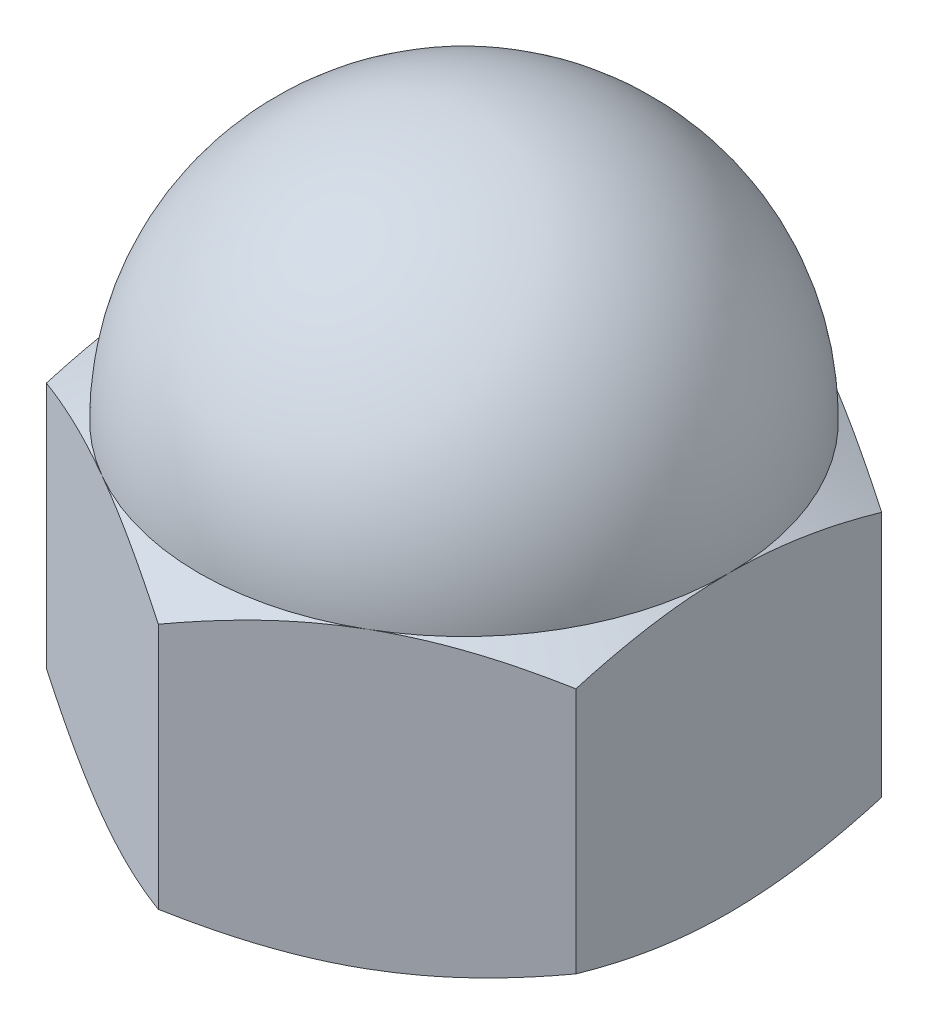
from build123d import *

# Parameters (mm, degrees)
EXTRUDE_1_DEPTH     = 10
HOLE_WIZARD_M12_1_D = 10.2
CHAMFER_2_SIZE      = 1


with BuildPart() as part:
    # 草图1 → 凸台-拉伸1 (new body)
    with BuildSketch(Plane(origin=(0, 0, 0), x_dir=(1, 0, 0), z_dir=(0, 1, 0))):
        Polygon((9, -5.196152423), (9, 5.196152423), (0, 10.392304845), (-9, 5.196152423), (-9, -5.196152423), (0, -10.392304845), align=None)
    extrude(amount=EXTRUDE_1_DEPTH)

    # 草图3 → 切除-旋转1 (revolve, cut)
    with BuildSketch(Plane(origin=(0, 0, 0), x_dir=(0, 0, -1), z_dir=(1, 0, 0))):
        Polygon((9, 10), (10.392304845, 9.196152423), (10.392304845, 10), align=None)
    cut_revolve_1 = revolve(axis=Axis((0, 12.408393564, 0), (0, -1, 0)), mode=Mode.SUBTRACT)

    # 镜向1: 切除-旋转1 across plane
    add(cut_revolve_1.mirror(Plane.ZX.offset(5)), mode=Mode.SUBTRACT)

    # M12 螺纹孔1 (through all)
    with Locations(Plane(origin=(0, 0, 0), x_dir=(-1, 0, 0), z_dir=(0, -1, 0))):
        with Locations((0, 0)):
            Hole(HOLE_WIZARD_M12_1_D / 2)

    # 倒角2
    chamfer_2_edges = [part.edges().sort_by_distance(p)[0] for p in [
        (-5.1, 0, 0),
        (-5.1, 10, 0),
    ]]
    chamfer(chamfer_2_edges, length=CHAMFER_2_SIZE)

    # 草图9 → 旋转-薄壁1 (revolve)
    with BuildSketch(Plane(origin=(0, 0, 0), x_dir=(0, 0, -1), z_dir=(1, 0, 0)), mode=Mode.PRIVATE) as revolve_1_sk:
        with BuildLine():
            ThreePointArc((0, 19), (6.363961031, 16.363961031), (9, 10))
            Line((9, 10), (8, 10))
            ThreePointArc((8, 10), (5.656854249, 15.656854249), (0, 18))
            Line((0, 18), (0, 19))
        make_face()
    revolve(revolve_1_sk.sketch.rotate(Axis((0, 21.479292142, 0), (0, -1, 0)), 180), axis=Axis((0, 21.479292142, 0), (0, -1, 0)))


solid = part.part
